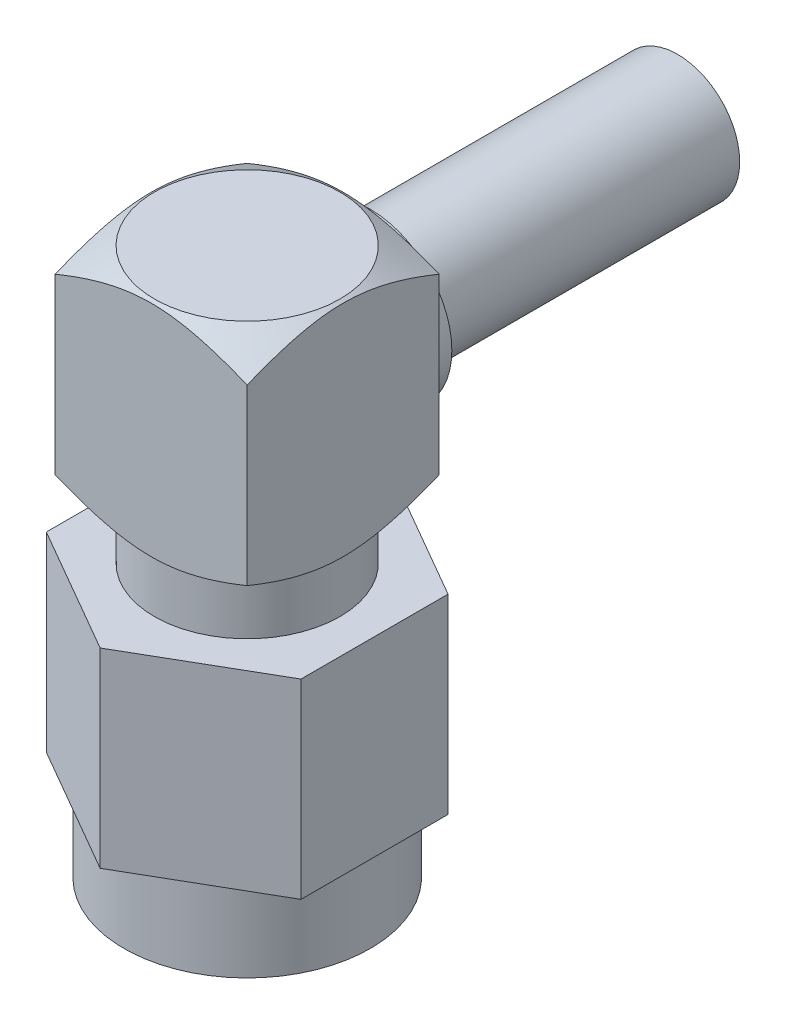
from build123d import *

# Parameters (mm, degrees)
SKETCH1_W           = 5.9944
SKETCH1_H           = 5.9944
BOSS_EXTRUDE1_DEPTH = 8.5852
SKETCH3_R           = 2.54
BOSS_EXTRUDE2_DEPTH = 0.8509
SKETCH4_R           = 1.93675
BOSS_EXTRUDE3_DEPTH = 9.5885
BOSS_EXTRUDE4_DEPTH = 5.9563
SKETCH6_R           = 3.8481
BOSS_EXTRUDE5_DEPTH = 2.54
SKETCH7_R           = 3.2512
CUT_EXTRUDE1_DEPTH  = 2.54


with BuildPart() as part:
    # Sketch1 → Boss-Extrude1 (new body)
    with BuildSketch(Plane(origin=(0, 0, 0), x_dir=(1, 0, 0), z_dir=(0, 1, 0))):
        Rectangle(SKETCH1_W, SKETCH1_H)
    extrude(amount=BOSS_EXTRUDE1_DEPTH)

    # Sketch2 → Cut-Revolve1 (revolve, cut)
    with BuildSketch(Plane.XY):
        Polygon((2.8956, 1.6129), (2.8956, 0), (5.460904916, -1.481079484), (5.460904916, 3.093979484), align=None)
        Polygon((2.9972, 8.5852), (2.8956, 8.5852), (5.460904916, 7.104120516), (5.460904916, 8.5852), align=None)
    revolve(axis=Axis((0, 0.80645, 0), (0, 1, 0)), mode=Mode.SUBTRACT)

    # Sketch3 → Boss-Extrude2 (add)
    with BuildSketch(Plane(origin=(0, 0, -2.9972), x_dir=(-1, 0, 0), z_dir=(0, 0, -1))):
        with Locations(Location((0, 5.09905, 0), (0, 0, 180))):
            Circle(SKETCH3_R)
    extrude(amount=BOSS_EXTRUDE2_DEPTH)

    # Sketch4 → Boss-Extrude3 (add)
    with BuildSketch(Plane(origin=(0, 0, -3.8481), x_dir=(-1, 0, 0), z_dir=(0, 0, -1))):
        with Locations(Location((0, 5.09905, 0), (0, 0, 180))):
            Circle(SKETCH4_R)
    extrude(amount=BOSS_EXTRUDE3_DEPTH)

    # Sketch5 → Boss-Extrude4 (add)
    with BuildSketch(Plane(origin=(0, 0, 0), x_dir=(-1, 0, 0), z_dir=(0, -1, 0))):
        Polygon((0, 4.59005011), (-3.9751, 2.295025055), (-3.9751, -2.295025055), (0, -4.59005011), (3.9751, -2.295025055), (3.9751, 2.295025055), align=None)
    extrude(amount=BOSS_EXTRUDE4_DEPTH)

    # Sketch6 → Boss-Extrude5 (add)
    with BuildSketch(Plane(origin=(0, -5.9563, 0), x_dir=(-1, 0, 0), z_dir=(0, -1, 0))):
        with Locations(Location((0, 0, 0), (0, 0, 90))):
            Circle(SKETCH6_R)
    extrude(amount=BOSS_EXTRUDE5_DEPTH)

    # Sketch7 → Cut-Extrude1 (cut)
    with BuildSketch(Plane(origin=(0, -8.4963, 0), x_dir=(-1, 0, 0), z_dir=(0, -1, 0))):
        with Locations(Location((0, 0, 0), (0, 0, 90))):
            Circle(SKETCH7_R)
    extrude(amount=-CUT_EXTRUDE1_DEPTH, mode=Mode.SUBTRACT)


solid = part.part
